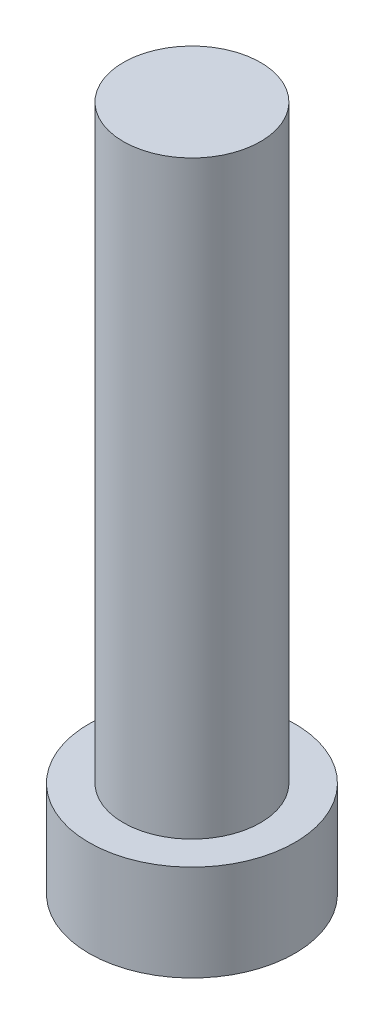
from build123d import *

# Parameters (mm, degrees)
SKETCH1_R           = 7.5
BOSS_EXTRUDE1_DEPTH = 7
SKETCH2_R           = 5
BOSS_EXTRUDE2_DEPTH = 43


with BuildPart() as part:
    # Sketch1 → Boss-Extrude1 (new body)
    with BuildSketch(Plane(origin=(0, 0, 0), x_dir=(1, 0, 0), z_dir=(0, 1, 0))):
        with Locations(Location((0, 0, 0), (0, 0, 270))):
            Circle(SKETCH1_R)
    extrude(amount=BOSS_EXTRUDE1_DEPTH)

    # Sketch2 → Boss-Extrude2 (add)
    with BuildSketch(Plane(origin=(0, 7, 0), x_dir=(1, 0, 0), z_dir=(0, 1, 0))):
        with Locations(Location((0, 0, 0), (0, 0, 270))):
            Circle(SKETCH2_R)
    extrude(amount=BOSS_EXTRUDE2_DEPTH)


solid = part.part
